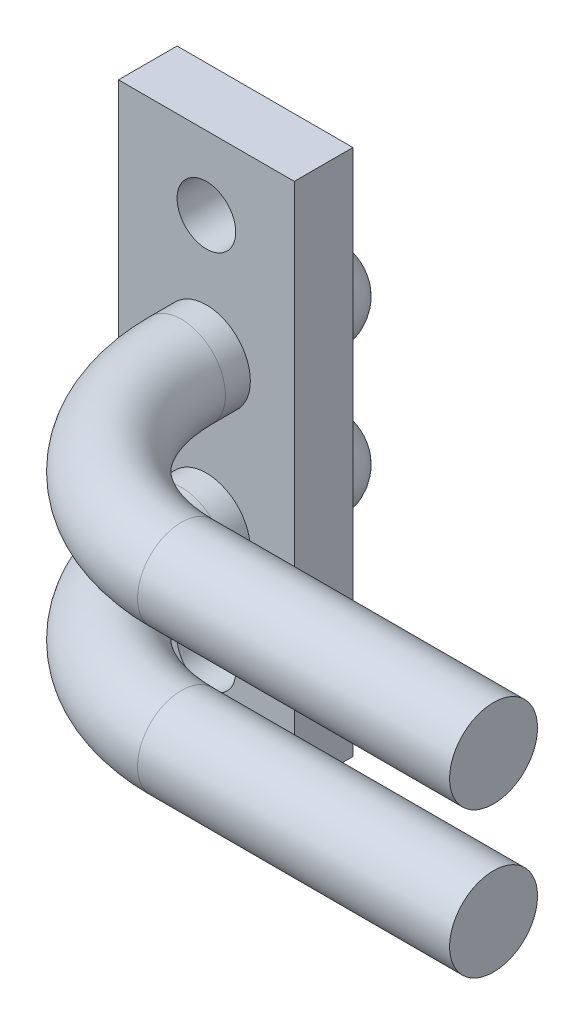
from build123d import *

# Parameters (mm, degrees)
SKETCH1_W           = 6
SKETCH1_H           = 18
BOSS_EXTRUDE1_DEPTH = 2
SKETCH2_R           = 1.5
BOSS_EXTRUDE2_DEPTH = 3
FILLET1_R           = 1.5
SKETCH3_R           = 1.5
SKETCH5_R           = 1
CUT_EXTRUDE1_DEPTH  = 21.686831601


with BuildPart() as part:
    # Sketch1 → Boss-Extrude1 (new body)
    with BuildSketch(Plane.XY):
        Rectangle(SKETCH1_W, SKETCH1_H)
    extrude(amount=BOSS_EXTRUDE1_DEPTH)

    # Sketch2 → Boss-Extrude2 (add)
    with BuildSketch(Plane(origin=(0, 0, 0), x_dir=(-1, 0, 0), z_dir=(0, 0, -1))):
        with Locations((0, 2.35)):
            Circle(SKETCH2_R)
        with Locations((0, -2.62)):
            Circle(SKETCH2_R)
    extrude(amount=BOSS_EXTRUDE2_DEPTH)

    # Fillet1
    fillet1_edges = [part.edges().sort_by_distance(p)[0] for p in [
        (1.5, 2.35, -3),
        (1.5, -2.62, -3),
    ]]
    fillet(fillet1_edges, radius=FILLET1_R)

    # Sweep1: sweep along a path in Sketch4
    with BuildLine(Plane(origin=(0, 2.35, 0), x_dir=(-1, 0, 0), z_dir=(0, 1, 0))) as sweep1_path:
        Line((0, 2), (0, 2.85))
        ThreePointArc((0, 2.85), (-1.757359313, 7.092640687), (-6, 8.85))
        Line((-6, 8.85), (-16.65, 8.85))
    # Sketch3 → Sweep1 (sweep)
    with BuildSketch(Plane.XY.offset(2)):
        with Locations((0, -2.62)):
            Circle(SKETCH3_R)
        with Locations((0, 2.35)):
            Circle(SKETCH3_R)
    sweep(path=sweep1_path.line)

    # Sketch5 → Cut-Extrude1 (cut, through all)
    with BuildSketch(Plane.XY.offset(2)):
        with Locations((0, 6.5)):
            Circle(SKETCH5_R)
        with Locations(Location((0, -6.5, 0), (0, 0, 180))):
            Circle(SKETCH5_R)
    extrude(amount=-CUT_EXTRUDE1_DEPTH, mode=Mode.SUBTRACT)


solid = part.part
